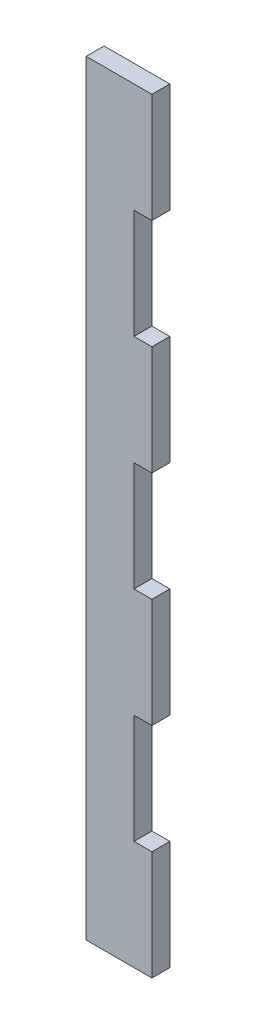
from build123d import *

# Parameters (mm, degrees)
SKETCH1_W           = 6.35
SKETCH1_H           = 203.2
SKETCH1_W_2         = 4.7625
SKETCH1_H_2         = 29.028571429
BOSS_EXTRUDE1_DEPTH = 4.7625


with BuildPart() as part:
    # Sketch1 → Boss-Extrude1 (new body)
    with BuildSketch(Plane.XY):
        with Locations((-3.175, 0)):
            Rectangle(SKETCH1_W, SKETCH1_H)
        Polygon((6.35, 101.6), (0, 101.6), (0, -101.6), (6.35, -101.6), (6.35, -72.571428571), (6.35, -43.542857143), (6.35, -14.514285714), (6.35, 14.514285714), (6.35, 43.542857143), (6.35, 72.571428571), align=None)
        with Locations((8.73125, 87.085714286)):
            Rectangle(SKETCH1_W_2, SKETCH1_H_2)
        with Locations((8.73125, 29.028571429)):
            Rectangle(SKETCH1_W_2, SKETCH1_H_2)
        with Locations((8.73125, -29.028571429)):
            Rectangle(SKETCH1_W_2, SKETCH1_H_2)
        with Locations((8.73125, -87.085714286)):
            Rectangle(SKETCH1_W_2, SKETCH1_H_2)
    extrude(amount=BOSS_EXTRUDE1_DEPTH)


solid = part.part
